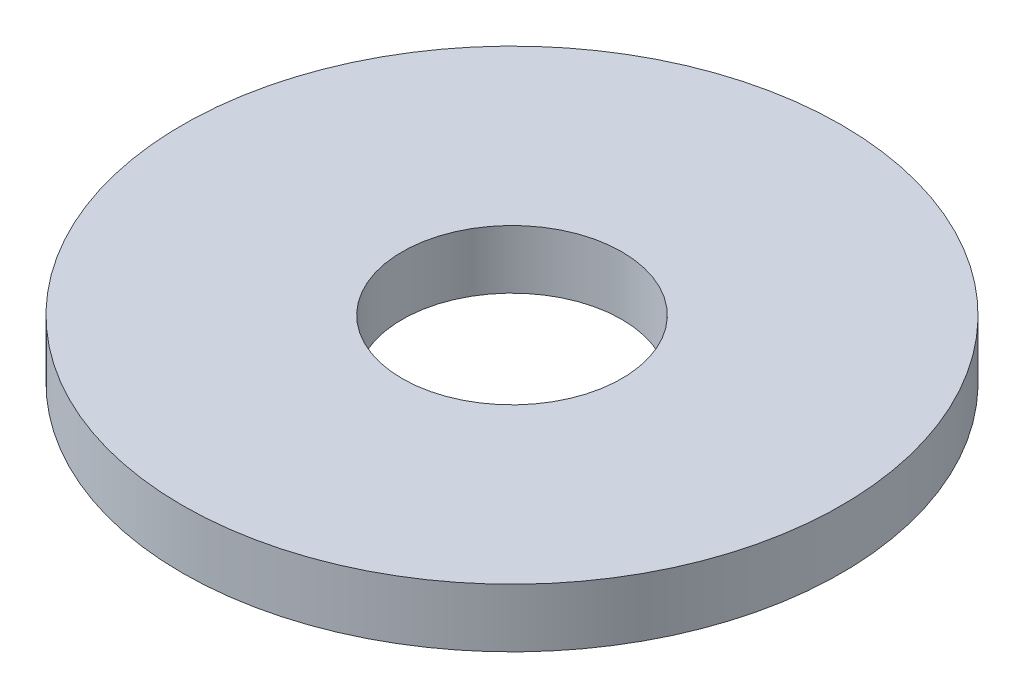
from build123d import *

# Parameters (mm, degrees)
SKETCH1_R           = 9
SKETCH1_R_2         = 3
BOSS_EXTRUDE1_DEPTH = 1.6


with BuildPart() as part:
    # Sketch1 → Boss-Extrude1 (new body)
    with BuildSketch(Plane(origin=(0, 0, 0), x_dir=(1, 0, 0), z_dir=(0, 1, 0))):
        with Locations(Location((0, 0, 0), (0, 0, 270))):
            Circle(SKETCH1_R)
        with Locations(Location((0, 0, 0), (0, 0, 270))):
            Circle(SKETCH1_R_2, mode=Mode.SUBTRACT)
    extrude(amount=BOSS_EXTRUDE1_DEPTH)


solid = part.part
